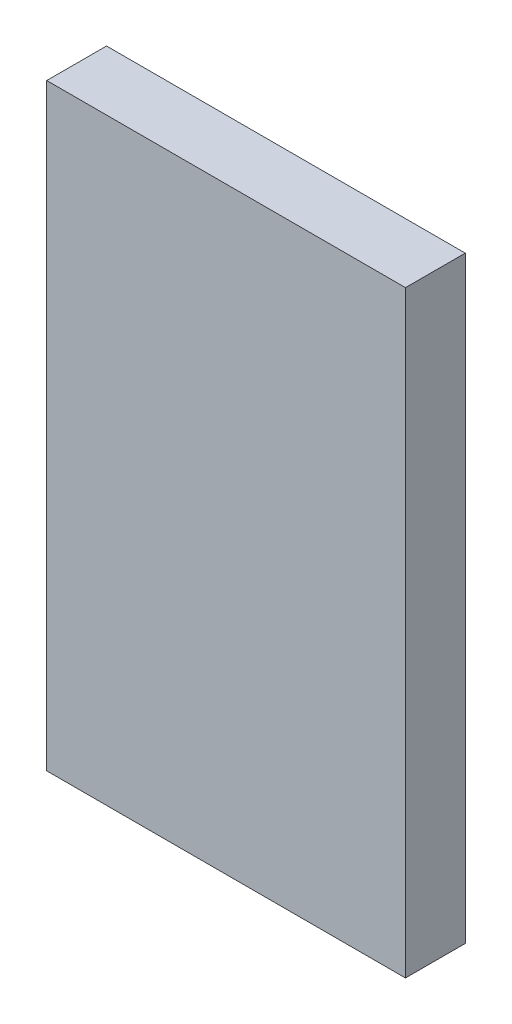
from build123d import *

# Parameters (mm, degrees)
ESQUISSE1_W        = 38.1
ESQUISSE1_H        = 63.5
BOSS_EXTRU_1_DEPTH = 3.175


with BuildPart() as part:
    # Esquisse1 → Boss.-Extru.1 (new, symmetric)
    with BuildSketch(Plane.XY):
        Rectangle(ESQUISSE1_W, ESQUISSE1_H)
    extrude(amount=BOSS_EXTRU_1_DEPTH, both=True)


solid = part.part
